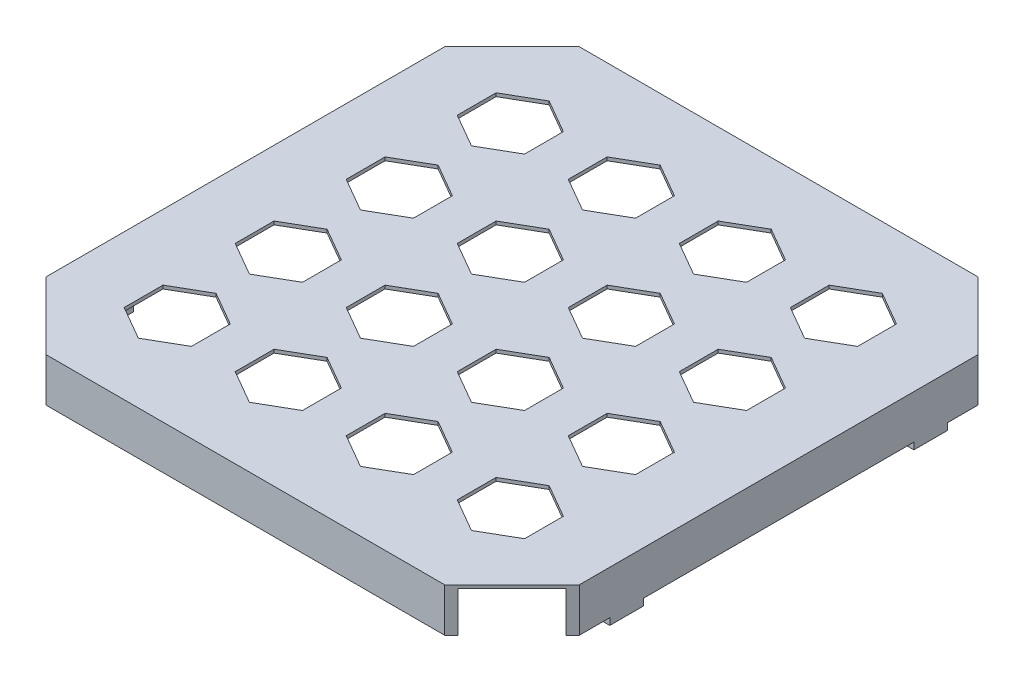
from build123d import *

# Parameters (mm, degrees)
BOSS_EXTRUDE1_DEPTH = 13
SKETCH5_W           = 154.5
SKETCH5_H           = 154.5
CUT_EXTRUDE3_DEPTH  = 12
CUT_EXTRUDE4_DEPTH  = 11
SKETCH8_W           = 5
SKETCH8_H           = 10
BOSS_EXTRUDE2_DEPTH = 2
SKETCH9_W           = 10
SKETCH9_H           = 5
BOSS_EXTRUDE3_DEPTH = 2
SKETCH11_W          = 10
SKETCH11_H          = 4.300504792
BOSS_EXTRUDE4_DEPTH = 2


with BuildPart() as part:
    # Sketch1 → Boss-Extrude1 (new body)
    with BuildSketch(Plane(origin=(0, 0, 0), x_dir=(1, 0, 0), z_dir=(0, 1, 0))):
        Polygon((20, 158.5), (0, 138.5), (0, 20), (20, 0), (138.5, 0), (158.5, 20), (158.5, 138.5), (138.5, 158.5), align=None)
    extrude(amount=BOSS_EXTRUDE1_DEPTH)

    # Sketch5 → Cut-Extrude3 (cut)
    with BuildSketch(Plane.XZ):
        with Locations((79.25, -79.25)):
            Rectangle(SKETCH5_W, SKETCH5_H)
    extrude(amount=-CUT_EXTRUDE3_DEPTH, mode=Mode.SUBTRACT)

    # Sketch7 → Cut-Extrude4 (cut)
    with BuildSketch(Plane(origin=(0, 13, 0), x_dir=(1, 0, 0), z_dir=(0, 1, 0))):
        Polygon((138.5, 122.726497308), (138.5, 134.273502692), (128.5, 140.047005384), (118.5, 134.273502692), (118.5, 122.726497308), (128.5, 116.952994616), align=None)
        Polygon((105.5, 122.726497308), (105.5, 134.273502692), (95.5, 140.047005384), (85.5, 134.273502692), (85.5, 122.726497308), (95.5, 116.952994616), align=None)
        Polygon((72.5, 122.726497308), (72.5, 134.273502692), (62.5, 140.047005384), (52.5, 134.273502692), (52.5, 122.726497308), (62.5, 116.952994616), align=None)
        Polygon((39.5, 122.726497308), (39.5, 134.273502692), (29.5, 140.047005384), (19.5, 134.273502692), (19.5, 122.726497308), (29.5, 116.952994616), align=None)
        Polygon((105.5, 89.726497308), (105.5, 101.273502692), (95.5, 107.047005384), (85.5, 101.273502692), (85.5, 89.726497308), (95.5, 83.952994616), align=None)
        Polygon((72.5, 89.726497308), (72.5, 101.273502692), (62.5, 107.047005384), (52.5, 101.273502692), (52.5, 89.726497308), (62.5, 83.952994616), align=None)
        Polygon((39.5, 89.726497308), (39.5, 101.273502692), (29.5, 107.047005384), (19.5, 101.273502692), (19.5, 89.726497308), (29.5, 83.952994616), align=None)
        Polygon((105.5, 56.726497308), (105.5, 68.273502692), (95.5, 74.047005384), (85.5, 68.273502692), (85.5, 56.726497308), (95.5, 50.952994616), align=None)
        Polygon((72.5, 56.726497308), (72.5, 68.273502692), (62.5, 74.047005384), (52.5, 68.273502692), (52.5, 56.726497308), (62.5, 50.952994616), align=None)
        Polygon((39.5, 56.726497308), (39.5, 68.273502692), (29.5, 74.047005384), (19.5, 68.273502692), (19.5, 56.726497308), (29.5, 50.952994616), align=None)
        Polygon((105.5, 23.726497308), (105.5, 35.273502692), (95.5, 41.047005384), (85.5, 35.273502692), (85.5, 23.726497308), (95.5, 17.952994616), align=None)
        Polygon((72.5, 23.726497308), (72.5, 35.273502692), (62.5, 41.047005384), (52.5, 35.273502692), (52.5, 23.726497308), (62.5, 17.952994616), align=None)
        Polygon((39.5, 23.726497308), (39.5, 35.273502692), (29.5, 41.047005384), (19.5, 35.273502692), (19.5, 23.726497308), (29.5, 17.952994616), align=None)
        Polygon((138.5, 89.726497308), (138.5, 101.273502692), (128.5, 107.047005384), (118.5, 101.273502692), (118.5, 89.726497308), (128.5, 83.952994616), align=None)
        Polygon((138.5, 56.726497308), (138.5, 68.273502692), (128.5, 74.047005384), (118.5, 68.273502692), (118.5, 56.726497308), (128.5, 50.952994616), align=None)
        Polygon((138.5, 23.726497308), (138.5, 35.273502692), (128.5, 41.047005384), (118.5, 35.273502692), (118.5, 23.726497308), (128.5, 17.952994616), align=None)
    extrude(amount=-CUT_EXTRUDE4_DEPTH, mode=Mode.SUBTRACT)

    # Sketch8 → Boss-Extrude2 (add)
    with BuildSketch(Plane.XZ):
        with Locations((2.5, -34.05439508)):
            Rectangle(SKETCH8_W, SKETCH8_H)
        with Locations((2.5, -124.44560492)):
            Rectangle(SKETCH8_W, SKETCH8_H)
        with Locations((156, -124.44560492)):
            Rectangle(SKETCH8_W, SKETCH8_H)
        with Locations((156, -34.05439508)):
            Rectangle(SKETCH8_W, SKETCH8_H)
    extrude(amount=BOSS_EXTRUDE2_DEPTH)

    # Sketch9 → Boss-Extrude3 (add)
    with BuildSketch(Plane(origin=(5, 0, 0), x_dir=(0, 0, -1), z_dir=(1, 0, 0))):
        with Locations((124.44560492, 0.5)):
            Rectangle(SKETCH9_W, SKETCH9_H)
        with Locations((34.05439508, 0.5)):
            Rectangle(SKETCH9_W, SKETCH9_H)
    extrude(amount=BOSS_EXTRUDE3_DEPTH)

    # Sketch11 → Boss-Extrude4 (add)
    with BuildSketch(Plane.ZY.offset(-153.5)):
        with Locations((-124.44560492, 0.150252396)):
            Rectangle(SKETCH11_W, SKETCH11_H)
        with Locations((-34.05439508, 0.150252396)):
            Rectangle(SKETCH11_W, SKETCH11_H)
    extrude(amount=BOSS_EXTRUDE4_DEPTH)


solid = part.part
